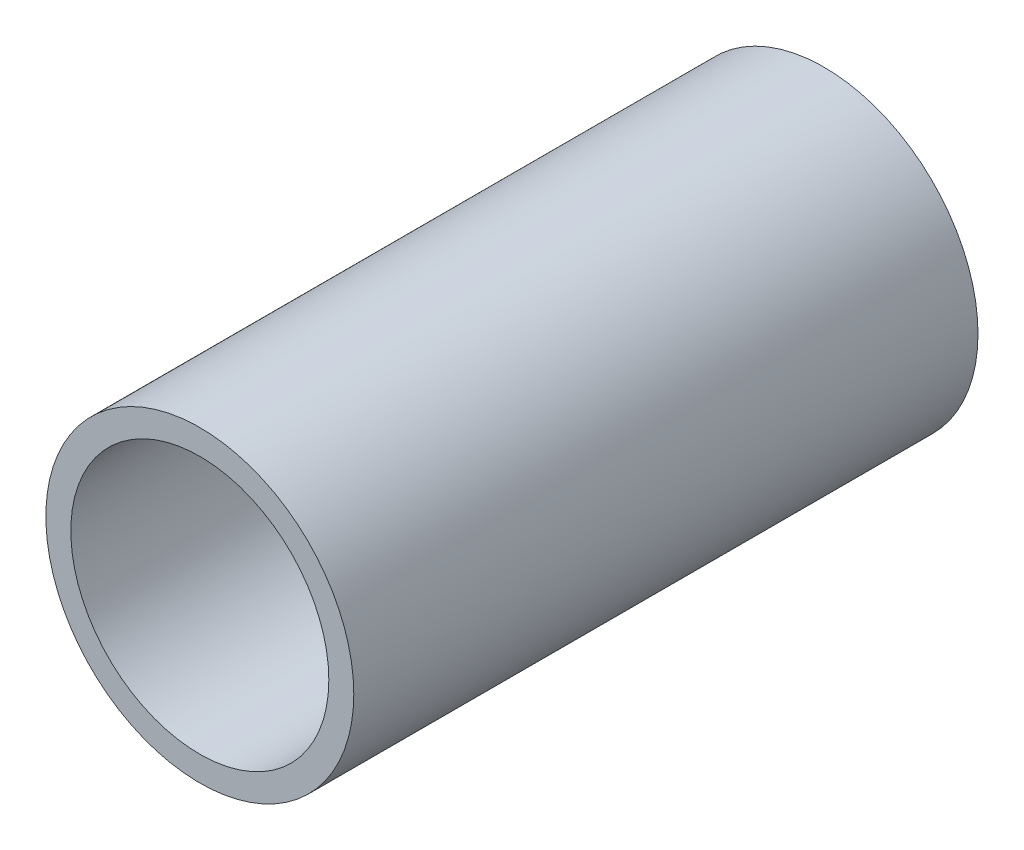
from build123d import *

# Parameters (mm, degrees)
SKETCH1_R           = 3.7
SKETCH1_R_2         = 3.1
BOSS_EXTRUDE1_DEPTH = 15


with BuildPart() as part:
    # Sketch1 → Boss-Extrude1 (new body)
    with BuildSketch(Plane.XY):
        Circle(SKETCH1_R)
        Circle(SKETCH1_R_2, mode=Mode.SUBTRACT)
    extrude(amount=BOSS_EXTRUDE1_DEPTH)


solid = part.part
